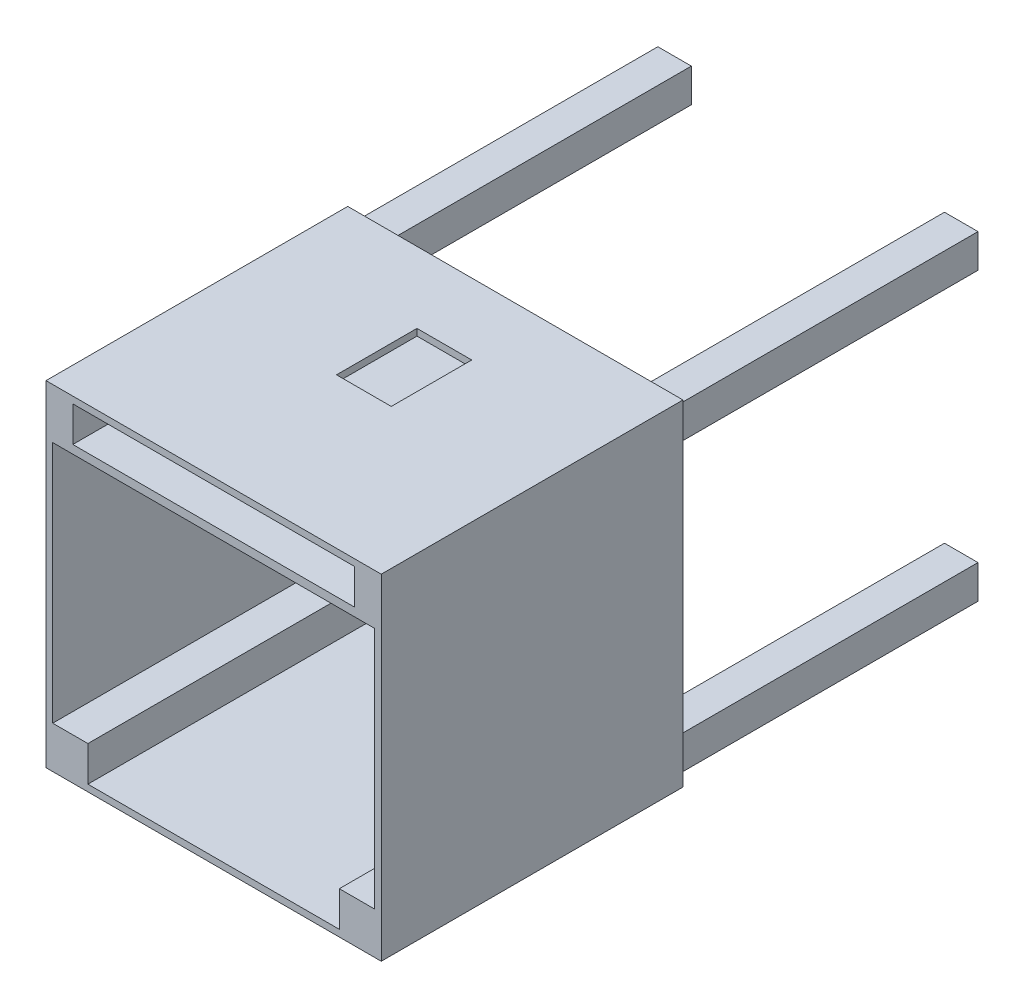
from build123d import *

# Parameters (mm, degrees)
SKETCH_1_W                       = 40
SKETCH_1_H                       = 90
EXTRUDE_1_DEPTH                  = 40
SKETCH_2_W                       = 200
SKETCH_2_H                       = 200
EXTRUDE_2_DEPTH                  = 180
FILLET_3_R                       = 34
SHELL_5_T                        = -4
SKETCH_5_W                       = 32
SKETCH_5_H                       = 82
CUT_EXTRUDE_3_DEPTH              = 18
SKETCH_6_W                       = 20
SKETCH_6_H                       = 20
EXTRUDE_3_DEPTH                  = 360
SKETCH_7_W                       = 21
SKETCH_7_H                       = 21
EXTRUDE_4_DEPTH                  = 180
PATTERN_LINEAR_1_COUNT           = 2
PATTERN_LINEAR_1_PITCH           = 171
PATTERN_LINEAR_2_COUNT           = 2
PATTERN_LINEAR_2_PITCH           = 171
PATTERN_LINEAR_2_COPY_1_SKETCH_W = 20
PATTERN_LINEAR_2_COPY_1_SKETCH_H = 20
PATTERN_LINEAR_2_COPY_1_DEPTH    = 360
PATTERN_LINEAR_2_COPY_2_SKETCH_W = 21
PATTERN_LINEAR_2_COPY_2_SKETCH_H = 21
PATTERN_LINEAR_2_COPY_2_DEPTH    = 180
EXTRUDE_START                    = 30
SKETCH_8_W                       = 10
SKETCH_8_H                       = 50
EXTRUDE_8_DEPTH                  = 30
SKETCH_11_W                      = 10
SKETCH_11_H                      = 50
EXTRUDE_9_DEPTH                  = 30
SKETCH_12_R                      = 4.01
CUT_EXTRUDE_4_DEPTH              = 10
EXTRUDE_10_REACH                 = 402.78
SKETCH_18_W                      = 9
SKETCH_18_H                      = 21
CUT_EXTRUDE_5_DEPTH              = 170
SKETCH_20_W                      = 32.66
SKETCH_20_H                      = 47.99
CUT_EXTRUDE_6_DEPTH              = 20
SKETCH_21_R                      = 7.5
CUT_EXTRUDE_7_DEPTH              = 260


with BuildPart() as part:
    # 草图1 → 凸台-拉伸1 (new body)
    with BuildSketch(Plane.XY):
        with Locations((0, 45)):
            Rectangle(SKETCH_1_W, SKETCH_1_H)
    extrude(amount=EXTRUDE_1_DEPTH)

    # 草图2 → 凸台-拉伸2 (add)
    with BuildSketch(Plane.XY.offset(40)):
        with Locations((0, 45)):
            Rectangle(SKETCH_2_W, SKETCH_2_H)
    extrude(amount=EXTRUDE_2_DEPTH)

    # 圆角3
    fillet_3_edges = [part.edges().sort_by_distance(p)[0] for p in [
        (20, 45, 40),
        (0, 90, 40),
        (-20, 45, 40),
        (0, 0, 40),
    ]]
    fillet(fillet_3_edges, radius=FILLET_3_R)

    # 抽壳5
    shell_5_openings = [part.faces().sort_by_distance(p)[0] for p in [
        (0, 45, 220),
    ]]
    offset(amount=SHELL_5_T, openings=shell_5_openings)

    # 草图5 → 切除-拉伸3 (cut)
    with BuildSketch(Plane.XY.offset(4)):
        with Locations((0, 45)):
            Rectangle(SKETCH_5_W, SKETCH_5_H)
    extrude(amount=-CUT_EXTRUDE_3_DEPTH, mode=Mode.SUBTRACT)

    # 草图6 → 凸台-拉伸3 (add)
    with BuildSketch(Plane.XY.offset(220)):
        with Locations((-85, 130)):
            Rectangle(SKETCH_6_W, SKETCH_6_H)
    extrude_3 = extrude(amount=-EXTRUDE_3_DEPTH)

    # 草图7 → 凸台-拉伸4 (add)
    with BuildSketch(Plane.XY.offset(220)):
        with Locations((-85.5, 130.5)):
            Rectangle(SKETCH_7_W, SKETCH_7_H)
    extrude_4 = extrude(amount=-EXTRUDE_4_DEPTH)

    # 阵列(线性)1: 凸台-拉伸3, 凸台-拉伸4 ×2
    with Locations(*[(i * PATTERN_LINEAR_1_PITCH, 0, 0) for i in range(1, PATTERN_LINEAR_1_COUNT)]):
        add(extrude_3)
        add(extrude_4)

    # 阵列(线性)2: 凸台-拉伸3, 凸台-拉伸4 ×2
    with Locations(*[(0, -i * PATTERN_LINEAR_2_PITCH, 0) for i in range(1, PATTERN_LINEAR_2_COUNT)]):
        add(extrude_3)
        add(extrude_4)

    # 阵列(线性)2 copy 1 sketch → 阵列(线性)2 copy 1 (add)
    with BuildSketch(Plane(origin=(171, -171, 220), x_dir=(1, 0, 0), z_dir=(0, 0, 1))):
        with Locations((-85, 130)):
            Rectangle(PATTERN_LINEAR_2_COPY_1_SKETCH_W, PATTERN_LINEAR_2_COPY_1_SKETCH_H)
    extrude(amount=-PATTERN_LINEAR_2_COPY_1_DEPTH)

    # 阵列(线性)2 copy 2 sketch → 阵列(线性)2 copy 2 (add)
    with BuildSketch(Plane(origin=(171, -171, 220), x_dir=(1, 0, 0), z_dir=(0, 0, 1))):
        with Locations((-85.5, 130.5)):
            Rectangle(PATTERN_LINEAR_2_COPY_2_SKETCH_W, PATTERN_LINEAR_2_COPY_2_SKETCH_H)
    extrude(amount=-PATTERN_LINEAR_2_COPY_2_DEPTH)

    # 草图8 → 凸台-拉伸8 (add)
    with BuildSketch(Plane.ZY.offset(20).offset(EXTRUDE_START)):
        with Locations((5, 45.224395516)):
            Rectangle(SKETCH_8_W, SKETCH_8_H)
    extrude(amount=-EXTRUDE_8_DEPTH)

    # 草图11 → 凸台-拉伸9 (add)
    with BuildSketch(Plane(origin=(20, 0, 0), x_dir=(0, 0, -1), z_dir=(1, 0, 0))):
        with Locations((-5, 45)):
            Rectangle(SKETCH_11_W, SKETCH_11_H)
    extrude(amount=EXTRUDE_9_DEPTH)

    # 草图12 → 切除-拉伸4 (cut)
    with BuildSketch(Plane(origin=(0, 0, 0), x_dir=(-1, 0, 0), z_dir=(0, 0, -1))):
        with Locations((-35, 45.224395516)):
            Circle(SKETCH_12_R)
        with Locations((35, 45.224395516)):
            Circle(SKETCH_12_R)
    extrude(amount=-CUT_EXTRUDE_4_DEPTH, mode=Mode.SUBTRACT)

    # 草图17 → 凸台-拉伸10 (add, up to next)
    with BuildSketch(Plane.XY.offset(220), mode=Mode.PRIVATE) as extrude_10_sk1:
        Polygon((-75, 120), (75, 120), (96, 120), (96, 115), (-96, 115), (-96, 120), align=None)
    extrude_10_tool1 = extrude(extrude_10_sk1.sketch, amount=-EXTRUDE_10_REACH, mode=Mode.PRIVATE) - part.part
    add(extrude_10_tool1.solids().sort_by_distance((0, 117.5, 220))[0])

    # 草图18 → 切除-拉伸5 (cut)
    with BuildSketch(Plane.XY.offset(220)):
        with Locations((79.5, 130.5)):
            Rectangle(SKETCH_18_W, SKETCH_18_H)
        with Locations((-79.5, 130.5)):
            Rectangle(SKETCH_18_W, SKETCH_18_H)
    extrude(amount=-CUT_EXTRUDE_5_DEPTH, mode=Mode.SUBTRACT)

    # 草图20 → 切除-拉伸6 (cut)
    with BuildSketch(Plane(origin=(0, 145, 0), x_dir=(1, 0, 0), z_dir=(0, 1, 0))):
        with Locations((0, -106.354128517)):
            Rectangle(SKETCH_20_W, SKETCH_20_H)
    extrude(amount=-CUT_EXTRUDE_6_DEPTH, mode=Mode.SUBTRACT)

    # 草图21 → 切除-拉伸7 (cut)
    with BuildSketch(Plane(origin=(0, 0, 40), x_dir=(-1, 0, 0), z_dir=(0, 0, -1))):
        with Locations(Location((0, 131, 0), (0, 0, 291.039469781))):
            Circle(SKETCH_21_R)
    extrude(amount=-CUT_EXTRUDE_7_DEPTH, mode=Mode.SUBTRACT)


solid = part.part
